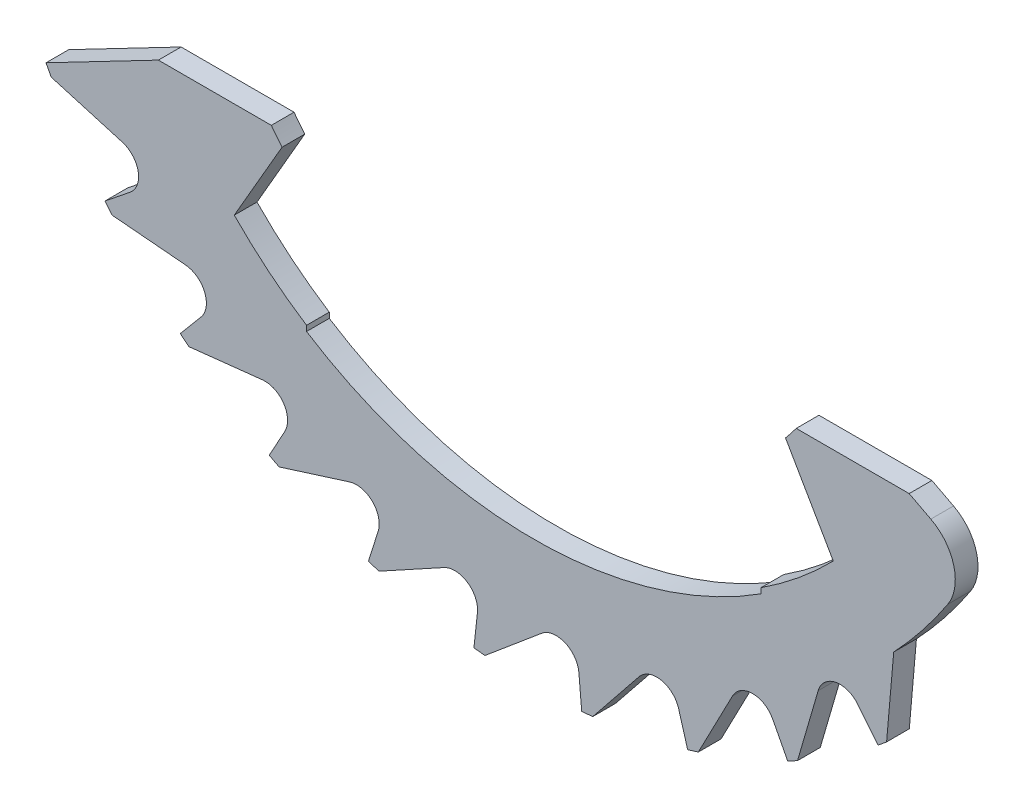
from build123d import *

# Parameters (mm, degrees)
BOSS_EXTRUDE1_DEPTH = 0.5
CUT_EXTRUDE1_REACH  = 18.182
CIRPATTERN1_COUNT   = 10
CIRPATTERN1_ANGLE   = 101.25
CUT_EXTRUDE3_START  = -0.5
CUT_EXTRUDE3_DEPTH  = 0.5
FILLET3_R           = 1


with BuildPart() as part:
    # Sketch1 → Boss-Extrude1 (new body)
    with BuildSketch(Plane.XY):
        with BuildLine():
            Line((-8.260223146, -4.3), (-10.732831081, -5.58715822))
            ThreePointArc((-10.732831081, -5.58715822), (0, -12.1), (10.732831081, -5.58715822))
            Line((10.732831081, -5.58715822), (8.260223146, -4.3))
            Line((8.260223146, -4.3), (5.774945887, -4.3))
            ThreePointArc((5.774945887, -4.3), (5.659072475, -4.451392897), (5.53923133, -4.5996648))
            Line((5.53923133, -4.5996648), (6.59, -6.419649523))
            ThreePointArc((6.59, -6.419649523), (5.831509763, -7.1157216), (5, -7.722693831))
            Line((5, -7.722693831), (5, -7.841555968))
            ThreePointArc((5, -7.841555968), (0, -9.3), (-5, -7.841555968))
            Line((-5, -7.841555968), (-5, -7.722693831))
            ThreePointArc((-5, -7.722693831), (-5.831509763, -7.1157216), (-6.59, -6.419649523))
            Line((-6.59, -6.419649523), (-5.53923133, -4.5996648))
            ThreePointArc((-5.53923133, -4.5996648), (-5.659072475, -4.451392897), (-5.774945887, -4.3))
            Line((-5.774945887, -4.3), (-8.260223146, -4.3))
        make_face()
    extrude(amount=BOSS_EXTRUDE1_DEPTH)

    # Sketch2 → Cut-Extrude1 (cut, up to next)
    with BuildSketch(Plane.XY.offset(0.5), mode=Mode.PRIVATE) as cut_extrude1_sk1:
        with BuildLine():
            Line((-10.617511084, -5.803314431), (-9.055174855, -6.258693914))
            ThreePointArc((-9.055174855, -6.258693914), (-8.704696722, -6.641173681), (-8.882127626, -7.128661083))
            Line((-8.882127626, -7.128661083), (-9.436602245, -7.573674013))
            ThreePointArc((-9.436602245, -7.573674013), (-10.066052286, -6.714506042), (-10.617511084, -5.803314431))
        make_face()
    cut_extrude1_tool1 = extrude(cut_extrude1_sk1.sketch, amount=-CUT_EXTRUDE1_REACH, mode=Mode.PRIVATE) & part.part
    cut_extrude1 = cut_extrude1_tool1.solids().sort_by_distance((-9.529687, -6.640526, 0.5))[0]
    add(cut_extrude1, mode=Mode.SUBTRACT)

    # CirPattern1: Cut-Extrude1 ×10 about axis
    cirpattern1_axis = Axis((0, 0, 0), (0, 0, 1))
    for i in range(1, CIRPATTERN1_COUNT):
        add(cut_extrude1.rotate(cirpattern1_axis, i * CIRPATTERN1_ANGLE / (CIRPATTERN1_COUNT - 1)), mode=Mode.SUBTRACT)

    # Sketch3 → Cut-Extrude3 (cut)
    with BuildSketch(Plane.XY.offset(0.5).offset(CUT_EXTRUDE3_START)):
        with BuildLine():
            Line((7.919995926, -7.488902759), (7.763179028, -9.281328104))
            ThreePointArc((7.763179028, -9.281328104), (9.430658528, -7.581073784), (10.732831081, -5.58715822))
            Line((10.732831081, -5.58715822), (9.668418082, -5.033059884))
            ThreePointArc((9.668418082, -5.033059884), (8.879519575, -6.321719079), (7.919995926, -7.488902759))
        make_face()
    extrude(amount=CUT_EXTRUDE3_DEPTH, mode=Mode.SUBTRACT)

    # Fillet3
    fillet3_edges = [part.edges().sort_by_distance(p)[0] for p in [
        (9.668418082, -5.033059884, 0.25),
    ]]
    fillet(fillet3_edges, radius=FILLET3_R)


solid = part.part
